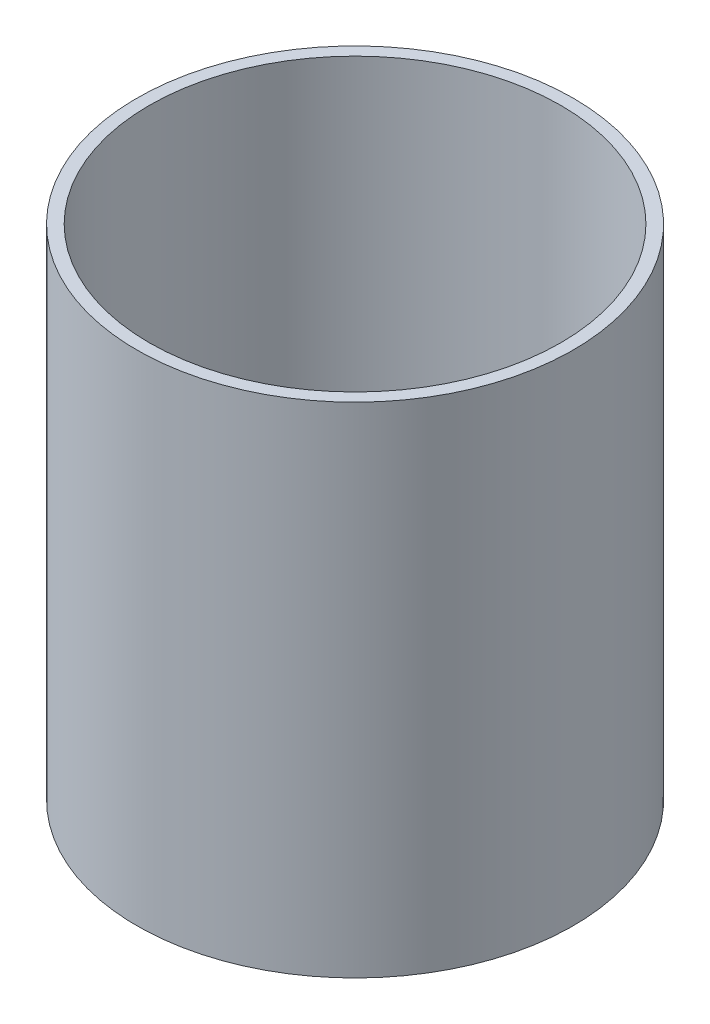
from build123d import *


with BuildPart() as part:
    # Croquis1 → Revolución1 (revolve)
    with BuildSketch(Plane(origin=(0, 0, 0), x_dir=(0, 0, -1), z_dir=(1, 0, 0)), mode=Mode.PRIVATE) as revoluci_n1_sk:
        Polygon((0, -209.123134328), (-165, -209.123134328), (-165, 180.876865672), (-175, 180.876865672), (-175, -219.123134328), (0, -219.123134328), align=None)
    revolve(revoluci_n1_sk.sketch.rotate(Axis((0, -219.123134328, 0), (0, 1, 0)), 180), axis=Axis((0, -219.123134328, 0), (0, 1, 0)))


solid = part.part
